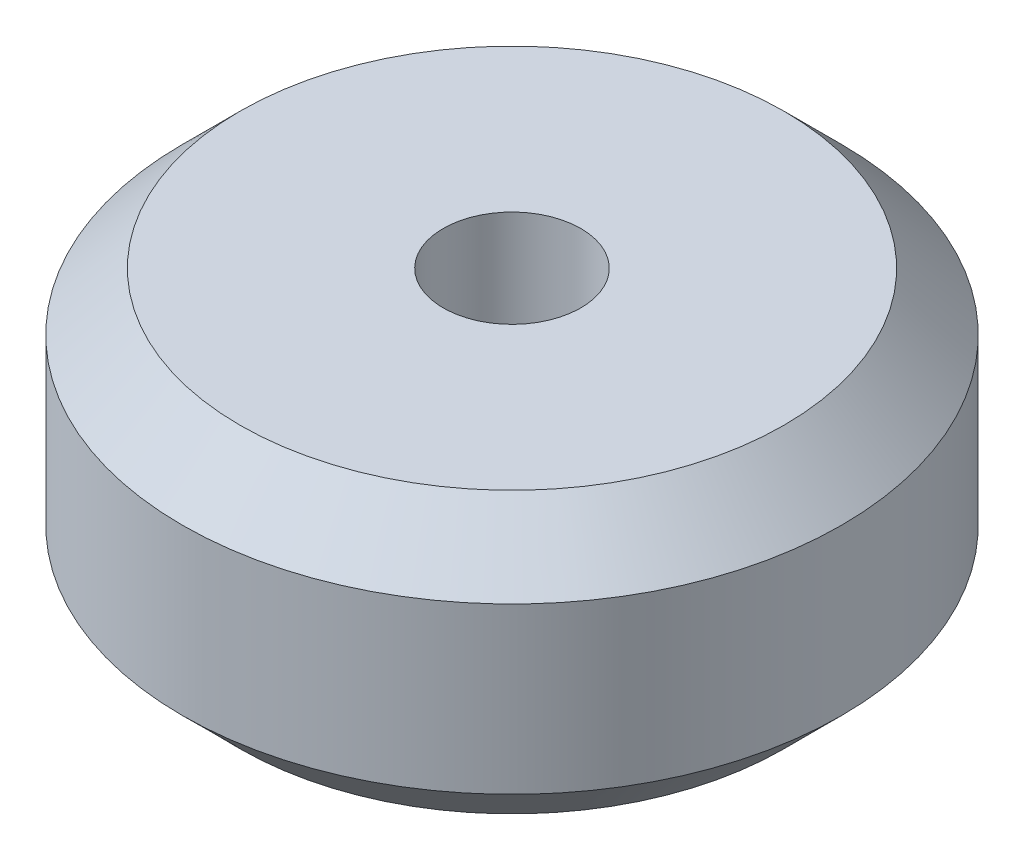
from build123d import *


with BuildPart() as part:
    # Sketch2 → Revolve1 (revolve)
    with BuildSketch(Plane.XY, mode=Mode.PRIVATE) as revolve1_sk:
        Polygon((2.505, -5.1), (2.505, 5.1), (9.9, 5.1), (12, 3), (12, -3), (9.9, -5.1), align=None)
    revolve(revolve1_sk.sketch.rotate(Axis((0, 0, 0), (0, 1, 0)), 90), axis=Axis((0, 0, 0), (0, 1, 0)))


solid = part.part
